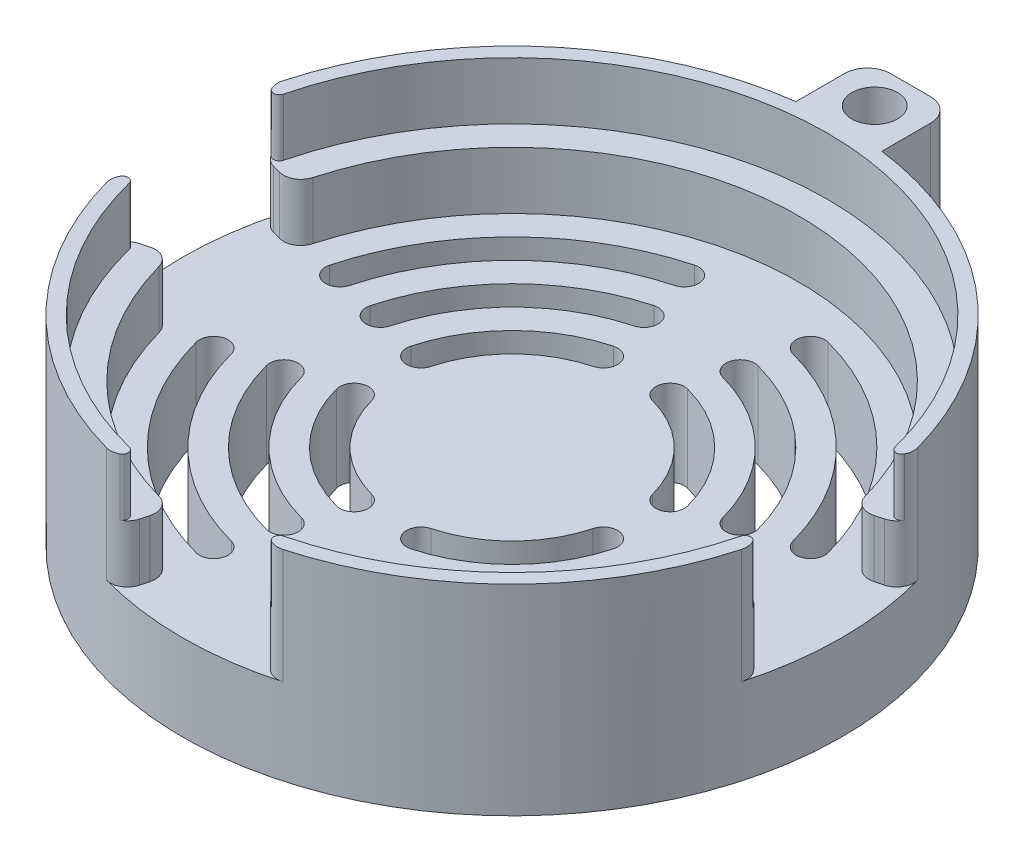
from build123d import *

# Parameters (mm, degrees)
CROQUIS1_R              = 57.5
SALIENTE_EXTRUIR1_DEPTH = 35
CROQUIS2_R              = 50
CORTAR_EXTRUIR1_DEPTH   = 20
SALIENTE_EXTRUIR2_START = -35
SALIENTE_EXTRUIR2_DEPTH = 35
REDONDEO1_R             = 4
CROQUIS4_R              = 55
CORTAR_EXTRUIR2_DEPTH   = 10
CORTAR_EXTRUIR3_DEPTH   = 93.393181567
MATRIZC1_COUNT          = 4
CORTAR_EXTRUIR4_REACH   = 98.755
REDONDEO2_R             = 3
REDONDEO3_R             = 3
REDONDEO4_R             = 1
MATRIZC2_COUNT          = 3
MATRIZC2_ANGLE          = 180
REDONDEO2_OF_MATRIZC2_R = 3
REDONDEO3_OF_MATRIZC2_R = 3
REDONDEO4_OF_MATRIZC2_R = 1
CROQUIS7_R              = 4
CORTAR_EXTRUIR5_DEPTH   = 97.754844912


with BuildPart() as part:
    # Croquis1 → Saliente-Extruir1 (new body)
    with BuildSketch(Plane(origin=(0, 0, 0), x_dir=(1, 0, 0), z_dir=(0, 1, 0))):
        with Locations(Location((0, 0, 0), (0, 0, 270))):
            Circle(CROQUIS1_R)
    extrude(amount=SALIENTE_EXTRUIR1_DEPTH)

    # Croquis2 → Cortar-Extruir1 (cut)
    with BuildSketch(Plane(origin=(0, 35, 0), x_dir=(1, 0, 0), z_dir=(0, 1, 0))):
        with Locations(Location((0, 0, 0), (0, 0, 270))):
            Circle(CROQUIS2_R)
    extrude(amount=-CORTAR_EXTRUIR1_DEPTH, mode=Mode.SUBTRACT)

    # Croquis3 → Saliente-Extruir2 (add)
    with BuildSketch(Plane(origin=(0, 35, 0), x_dir=(1, 0, 0), z_dir=(0, 1, 0)).offset(SALIENTE_EXTRUIR2_START)):
        with BuildLine():
            Line((-7.5, 57.008771255), (-7.5, 69.5))
            Line((-7.5, 69.5), (7.5, 69.5))
            Line((7.5, 69.5), (7.5, 57.008771255))
            ThreePointArc((7.5, 57.008771255), (0, 57.5), (-7.5, 57.008771255))
        make_face()
    extrude(amount=SALIENTE_EXTRUIR2_DEPTH)

    # Redondeo1
    redondeo1_edges = [part.edges().sort_by_distance(p)[0] for p in [
        (7.5, 17.5, -69.5),
        (-7.5, 17.5, -69.5),
    ]]
    fillet(redondeo1_edges, radius=REDONDEO1_R)

    # Croquis4 → Cortar-Extruir2 (cut)
    with BuildSketch(Plane(origin=(0, 35, 0), x_dir=(1, 0, 0), z_dir=(0, 1, 0))):
        with Locations(Location((0, 0, 0), (0, 0, 270))):
            Circle(CROQUIS4_R)
    extrude(amount=-CORTAR_EXTRUIR2_DEPTH, mode=Mode.SUBTRACT)

    # Croquis5 → Cortar-Extruir3 (cut, through all)
    with BuildSketch(Plane(origin=(0, 15, 0), x_dir=(1, 0, 0), z_dir=(0, 1, 0))):
        with BuildLine():
            ThreePointArc((-5.176380902, 19.318516526), (-3.408613949, 22.380378704), (-6.470476128, 24.148145657))
            ThreePointArc((-6.470476128, 24.148145657), (-17.67766953, 17.67766953), (-24.148145657, 6.470476128))
            ThreePointArc((-24.148145657, 6.470476128), (-22.380378704, 3.408613949), (-19.318516526, 5.176380902))
            ThreePointArc((-19.318516526, 5.176380902), (-14.142135624, 14.142135624), (-5.176380902, 19.318516526))
        make_face()
        with BuildLine():
            ThreePointArc((-7.764571353, 28.977774789), (-21.213203436, 21.213203436), (-28.977774789, 7.764571353))
            ThreePointArc((-28.977774789, 7.764571353), (-32.039636967, 5.9968044), (-33.80740392, 9.058666579))
            ThreePointArc((-33.80740392, 9.058666579), (-24.748737342, 24.748737342), (-9.058666579, 33.80740392))
            ThreePointArc((-9.058666579, 33.80740392), (-5.9968044, 32.039636967), (-7.764571353, 28.977774789))
        make_face()
        with BuildLine():
            ThreePointArc((-11.64685703, 43.466662183), (-31.819805153, 31.819805153), (-43.466662183, 11.64685703))
            ThreePointArc((-43.466662183, 11.64685703), (-41.69889523, 8.584994851), (-38.637033052, 10.352761804))
            ThreePointArc((-38.637033052, 10.352761804), (-28.284271247, 28.284271247), (-10.352761804, 38.637033052))
            ThreePointArc((-10.352761804, 38.637033052), (-8.584994851, 41.69889523), (-11.64685703, 43.466662183))
        make_face()
    cortar_extruir3 = extrude(amount=-CORTAR_EXTRUIR3_DEPTH, mode=Mode.SUBTRACT)

    # MatrizC1: Cortar-Extruir3 ×4 about axis
    matrizc1_axis = Axis((0, 0, 0), (0, 1, 0))
    for i in range(1, MATRIZC1_COUNT):
        add(cortar_extruir3.rotate(matrizc1_axis, i * 360 / MATRIZC1_COUNT), mode=Mode.SUBTRACT)

    # Cortar-Extruir4: up to this face of the body (flat: up to its plane)
    cortar_extruir4_end = Plane(part.part.faces().sort_by_distance((0, 15, 0))[0])
    # Croquis6 → Cortar-Extruir4 (cut, up to the picked face)
    with BuildSketch(Plane(origin=(0, 35, 0), x_dir=(1, 0, 0), z_dir=(0, 1, 0)), mode=Mode.PRIVATE) as cortar_extruir4_sk1:
        Polygon((-71.161592337, 16.479500748), (-16.636313028, 1.86949619), (-15.78023969, -1.64011203), (-63.577939744, -14.44746716), align=None)
    cortar_extruir4_tool1 = split(extrude(cortar_extruir4_sk1.sketch, amount=-CORTAR_EXTRUIR4_REACH, mode=Mode.PRIVATE), bisect_by=cortar_extruir4_end, keep=Keep.BOTH, mode=Mode.PRIVATE)
    cortar_extruir4 = cortar_extruir4_tool1.solids().sort_by(Axis((-48.577913, 35, -0.685184), (0, -1, 0)))[0]
    add(cortar_extruir4, mode=Mode.SUBTRACT)

    # Redondeo2
    redondeo2_edges = [part.edges().sort_by_distance(p)[0] for p in [
        (-48.882930784, 20, -10.509951376),
        (-56.135261823, 25, -12.453207621),
    ]]
    fillet(redondeo2_edges, radius=REDONDEO2_R)

    # Redondeo3
    redondeo3_edges = [part.edges().sort_by_distance(p)[0] for p in [
        (-48.882930784, 20, 10.509951376),
        (-56.135261823, 25, 12.453207621),
    ]]
    fillet(redondeo3_edges, radius=REDONDEO3_R)

    # Redondeo4
    redondeo4_edges = [part.edges().sort_by_distance(p)[0] for p in [
        (-53.710853389, 30, -11.838252752),
        (-53.710853389, 30, 11.838252752),
    ]]
    fillet(redondeo4_edges, radius=REDONDEO4_R)

    # MatrizC2: Cortar-Extruir4 ×3 about axis
    matrizc2_axis = Axis((0, 0, 0), (0, 1, 0))
    for i in range(1, MATRIZC2_COUNT):
        add(cortar_extruir4.rotate(matrizc2_axis, i * MATRIZC2_ANGLE / (MATRIZC2_COUNT - 1)), mode=Mode.SUBTRACT)

    # Redondeo2 of MatrizC2
    redondeo2_of_matrizc2_edges = [part.edges().sort_by_distance(p)[0] for p in [
        (-10.509951376, 20, 48.882930784),
        (-12.453207621, 25, 56.135261823),
        (48.882930784, 20, 10.509951376),
        (56.135261823, 25, 12.453207621),
    ]]
    fillet(redondeo2_of_matrizc2_edges, radius=REDONDEO2_OF_MATRIZC2_R)

    # Redondeo3 of MatrizC2
    redondeo3_of_matrizc2_edges = [part.edges().sort_by_distance(p)[0] for p in [
        (10.509951376, 20, 48.882930784),
        (12.453207621, 25, 56.135261823),
        (48.882930784, 20, -10.509951376),
        (56.135261823, 25, -12.453207621),
    ]]
    fillet(redondeo3_of_matrizc2_edges, radius=REDONDEO3_OF_MATRIZC2_R)

    # Redondeo4 of MatrizC2
    redondeo4_of_matrizc2_edges = [part.edges().sort_by_distance(p)[0] for p in [
        (-11.838252752, 30, 53.710853389),
        (11.838252752, 30, 53.710853389),
        (53.710853389, 30, 11.838252752),
        (53.710853389, 30, -11.838252752),
    ]]
    fillet(redondeo4_of_matrizc2_edges, radius=REDONDEO4_OF_MATRIZC2_R)

    # Croquis7 → Cortar-Extruir5 (cut, through all)
    with BuildSketch(Plane(origin=(0, 35, 0), x_dir=(1, 0, 0), z_dir=(0, 1, 0))):
        with Locations(Location((0, 63.254385627, 0), (0, 0, 270))):
            Circle(CROQUIS7_R)
    extrude(amount=-CORTAR_EXTRUIR5_DEPTH, mode=Mode.SUBTRACT)


solid = part.part
